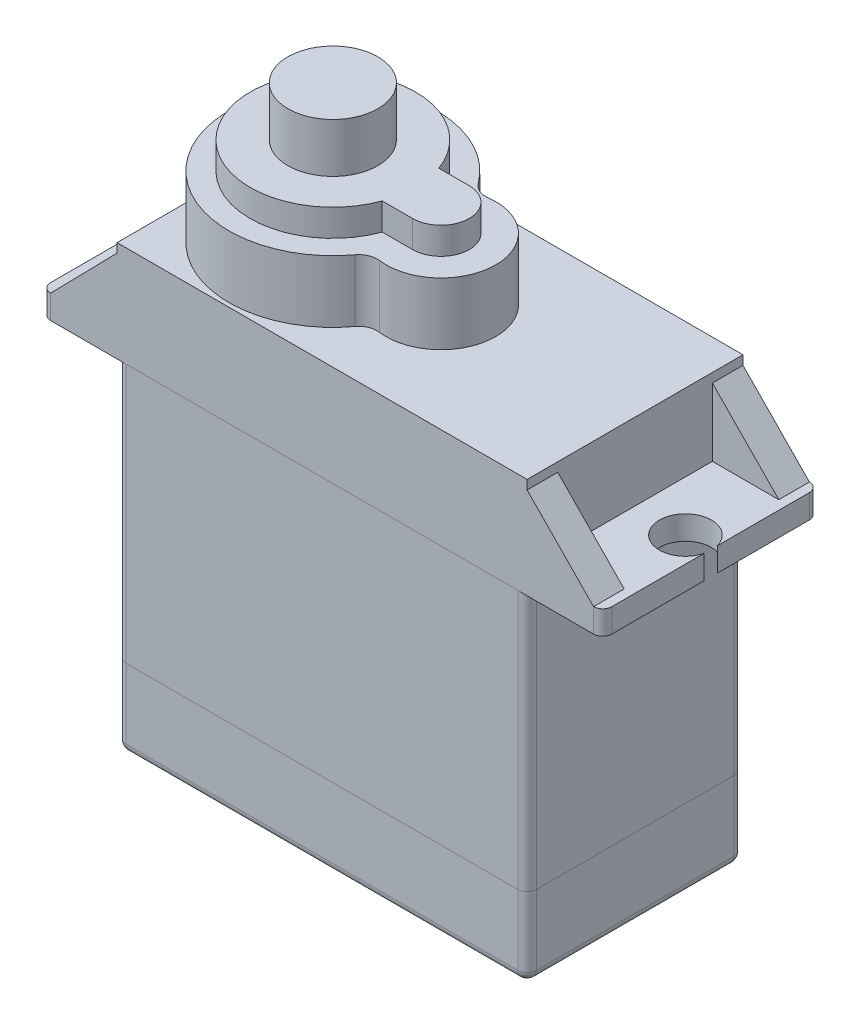
from build123d import *

# Parameters (mm, degrees)
SKETCH1_W               = 22.8
SKETCH1_H               = 12
BOSS_EXTRUDE1_DEPTH     = 4.4
SKETCH2_W               = 22.8
SKETCH2_H               = 12
BOSS_EXTRUDE4_DEPTH     = 14.4
SKETCH5_W               = 22.8
SKETCH5_H               = 12
BOSS_EXTRUDE6_DEPTH     = 5.6
SKETCH7_W               = 12
SKETCH7_H               = 1.3208
BOSS_EXTRUDE9_DEPTH     = 4.2
RIB7_REACH              = 37.485
SKETCH9_WALL_W          = 78.247992846
SKETCH9_WALL_H          = 1.7018
SKETCH10_R              = 1.4478
CUT_EXTRUDE1_DEPTH      = 1.3208
MIRROR2_COPY_1_REACH    = 37.485
MIRROR2_COPY_1_SKETCH_W = 78.247992846
MIRROR2_COPY_1_SKETCH_H = 1.7018
BOSS_EXTRUDE10_DEPTH    = 3.4544
FILLET1_R               = 0.508
FILLET3_R               = 0.508
BOSS_EXTRUDE11_DEPTH    = 1.4986
SKETCH13_R              = 2.5019
BOSS_EXTRUDE12_DEPTH    = 2.7432
SKETCH14_W              = 6.8834
SKETCH14_H              = 4.4
BOSS_EXTRUDE14_DEPTH    = 0.4064
SKETCH15_R              = 0.5715
BOSS_EXTRUDE15_DEPTH    = 1.27
BOSS_EXTRUDE15_2_DEPTH  = 1.27
BOSS_EXTRUDE15_3_DEPTH  = 1.27
FILLET4_R               = 0.508


with BuildPart() as part:
    # Sketch1 → Boss-Extrude1 (new body)
    with BuildSketch(Plane(origin=(0, 0, 0), x_dir=(1, 0, 0), z_dir=(0, 1, 0))):
        with Locations((11.4, 6)):
            Rectangle(SKETCH1_W, SKETCH1_H)
    extrude(amount=BOSS_EXTRUDE1_DEPTH)

    # Sketch14 → Boss-Extrude14 (add)
    with BuildSketch(Plane.ZY):
        with Locations((-6, 2.2)):
            Rectangle(SKETCH14_W, SKETCH14_H)
    extrude(amount=BOSS_EXTRUDE14_DEPTH)

    # Fillet4
    fillet4_edges = [part.edges().sort_by_distance(p)[0] for p in [
        (-0.2032, 0, -9.4417),
        (-0.4064, 0, -6),
        (-0.2032, 0, -2.5583),
        (0, 0, -1.27915),
        (11.4, 0, 0),
        (22.8, 0, -6),
        (11.4, 0, -12),
        (0, 0, -10.72085),
        (0, 2.2, 0),
        (22.8, 2.2, 0),
        (22.8, 2.2, -12),
        (0, 2.2, -12),
    ]]
    fillet(fillet4_edges, radius=FILLET4_R)


with BuildPart() as body_2:
    # Sketch2 → Boss-Extrude4 (new body)
    with BuildSketch(Plane(origin=(0, 4.4, 0), x_dir=(1, 0, 0), z_dir=(0, 1, 0))):
        with Locations((11.4, 6)):
            Rectangle(SKETCH2_W, SKETCH2_H)
    extrude(amount=BOSS_EXTRUDE4_DEPTH)

    # Fillet1
    fillet1_edges = [body_2.edges().sort_by_distance(p)[0] for p in [
        (0, 11.6, -12),
        (22.8, 11.6, -12),
        (22.8, 11.6, 0),
        (0, 11.6, 0),
    ]]
    fillet(fillet1_edges, radius=FILLET1_R)


with BuildPart() as body_3:
    # Sketch5 → Boss-Extrude6 (new body)
    with BuildSketch(Plane(origin=(0, 18.8, 0), x_dir=(1, 0, 0), z_dir=(0, 1, 0))):
        with Locations((11.4, 6)):
            Rectangle(SKETCH5_W, SKETCH5_H)
    extrude(amount=BOSS_EXTRUDE6_DEPTH)

    # Sketch7 → Boss-Extrude9 (add)
    with BuildSketch(Plane.ZY):
        with Locations((-6, 19.4604)):
            Rectangle(SKETCH7_W, SKETCH7_H)
    boss_extrude9 = extrude(amount=BOSS_EXTRUDE9_DEPTH)

    # Sketch9 wall → Rib7 (add, up to next)
    with BuildSketch(Plane(origin=(-1.846, 22.0064, 0), x_dir=(-0.699563524682, -0.71457041286, 0), z_dir=(0.71457041286, -0.699563524682, 0)), mode=Mode.PRIVATE) as rib7_sk1:
        with Locations((0, 0.8509)):
            Rectangle(SKETCH9_WALL_W, SKETCH9_WALL_H)
    rib7_tool1 = extrude(rib7_sk1.sketch, amount=RIB7_REACH, mode=Mode.PRIVATE) - body_3.part
    rib7 = rib7_tool1.solids().sort_by_distance((-1.846, 22.0064, 0))[0]
    add(rib7)

    # Mirror1: Rib7 across plane
    add(rib7.mirror(Plane(origin=(0, 0, -6), x_dir=(1, 0, 0), z_dir=(0, 0, -1))))

    # Sketch10 → Cut-Extrude1 (cut)
    with BuildSketch(Plane(origin=(0, 20.1208, 0), x_dir=(1, 0, 0), z_dir=(0, 1, 0))):
        with Locations((-2.8, 6)):
            Circle(SKETCH10_R)
    cut_extrude1 = extrude(amount=-CUT_EXTRUDE1_DEPTH, mode=Mode.SUBTRACT)

    # Mirror2: Boss-Extrude9, Rib7, Cut-Extrude1 across plane
    add(boss_extrude9.mirror(Plane.ZY.offset(-11.4)))
    add(rib7.mirror(Plane.ZY.offset(-11.4)))
    add(cut_extrude1.mirror(Plane.ZY.offset(-11.4)), mode=Mode.SUBTRACT)

    # Mirror2 copy 1 sketch → Mirror2 copy 1 (add, up to next)
    with BuildSketch(Plane(origin=(24.646, 22.0064, -12), x_dir=(0.699563524682, -0.71457041286, 0), z_dir=(-0.71457041286, -0.699563524682, 0)), mode=Mode.PRIVATE) as mirror2_copy_1_sk1:
        with Locations((0, 0.8509)):
            Rectangle(MIRROR2_COPY_1_SKETCH_W, MIRROR2_COPY_1_SKETCH_H)
    mirror2_copy_1_tool1 = extrude(mirror2_copy_1_sk1.sketch, amount=MIRROR2_COPY_1_REACH, mode=Mode.PRIVATE) - body_3.part
    add(mirror2_copy_1_tool1.solids().sort_by_distance((24.646, 22.0064, -12))[0])

    # Fillet3
    fillet3_edges = [body_3.edges().sort_by_distance(p)[0] for p in [
        (-4.2, 19.4604, 0),
        (-4.2, 19.4604, -12),
        (27, 19.4604, -12),
        (27, 19.4604, 0),
    ]]
    fillet(fillet3_edges, radius=FILLET3_R)


with BuildPart() as body_4:
    # Sketch11 → Boss-Extrude10 (new body)
    with BuildSketch(Plane(origin=(0, 24.4, 0), x_dir=(1, 0, 0), z_dir=(0, 1, 0))):
        with BuildLine():
            ThreePointArc((10.653238997, 9.426139093), (0.2215, 6), (10.653238997, 2.573860907))
            ThreePointArc((10.653238997, 2.573860907), (11.073906709, 2.906482777), (11.605318182, 2.978597119))
            ThreePointArc((11.605318182, 2.978597119), (15.0551, 6), (11.605318182, 9.021402881))
            ThreePointArc((11.605318182, 9.021402881), (11.073906709, 9.093517223), (10.653238997, 9.426139093))
        make_face()
    extrude(amount=BOSS_EXTRUDE10_DEPTH)

    # Sketch12 → Boss-Extrude11 (add)
    with BuildSketch(Plane(origin=(0, 27.8544, 0), x_dir=(1, 0, 0), z_dir=(0, 1, 0))):
        with BuildLine():
            Line((12.0071, 4.4252), (10.319269813, 4.4252))
            ThreePointArc((10.319269813, 4.4252), (1.4026, 6), (10.319269813, 7.5748))
            Line((10.319269813, 7.5748), (12.0071, 7.5748))
            ThreePointArc((12.0071, 7.5748), (13.5819, 6), (12.0071, 4.4252))
        make_face()
    extrude(amount=BOSS_EXTRUDE11_DEPTH)

    # Sketch13 → Boss-Extrude12 (add)
    with BuildSketch(Plane(origin=(0, 29.353, 0), x_dir=(1, 0, 0), z_dir=(0, 1, 0))):
        with Locations(Location((6, 6, 0), (0, 0, 270))):
            Circle(SKETCH13_R)
    extrude(amount=BOSS_EXTRUDE12_DEPTH)


with BuildPart() as body_5:
    # Sketch15 → Boss-Extrude15 (new body)
    with BuildSketch(Plane.ZY.offset(0.4064)):
        with Locations((-6, 1.778)):
            Circle(SKETCH15_R)
    extrude(amount=BOSS_EXTRUDE15_DEPTH)


with BuildPart() as body_6:
    # Sketch15 → Boss-Extrude15 2 (new body)
    with BuildSketch(Plane.ZY.offset(0.4064)):
        with Locations((-4.857, 1.778)):
            Circle(SKETCH15_R)
    extrude(amount=BOSS_EXTRUDE15_2_DEPTH)


with BuildPart() as body_7:
    # Sketch15 → Boss-Extrude15 3 (new body)
    with BuildSketch(Plane.ZY.offset(0.4064)):
        with Locations((-7.143, 1.778)):
            Circle(SKETCH15_R)
    extrude(amount=BOSS_EXTRUDE15_3_DEPTH)


solid = Compound([part.part, body_2.part, body_3.part, body_4.part, body_5.part, body_6.part, body_7.part])
